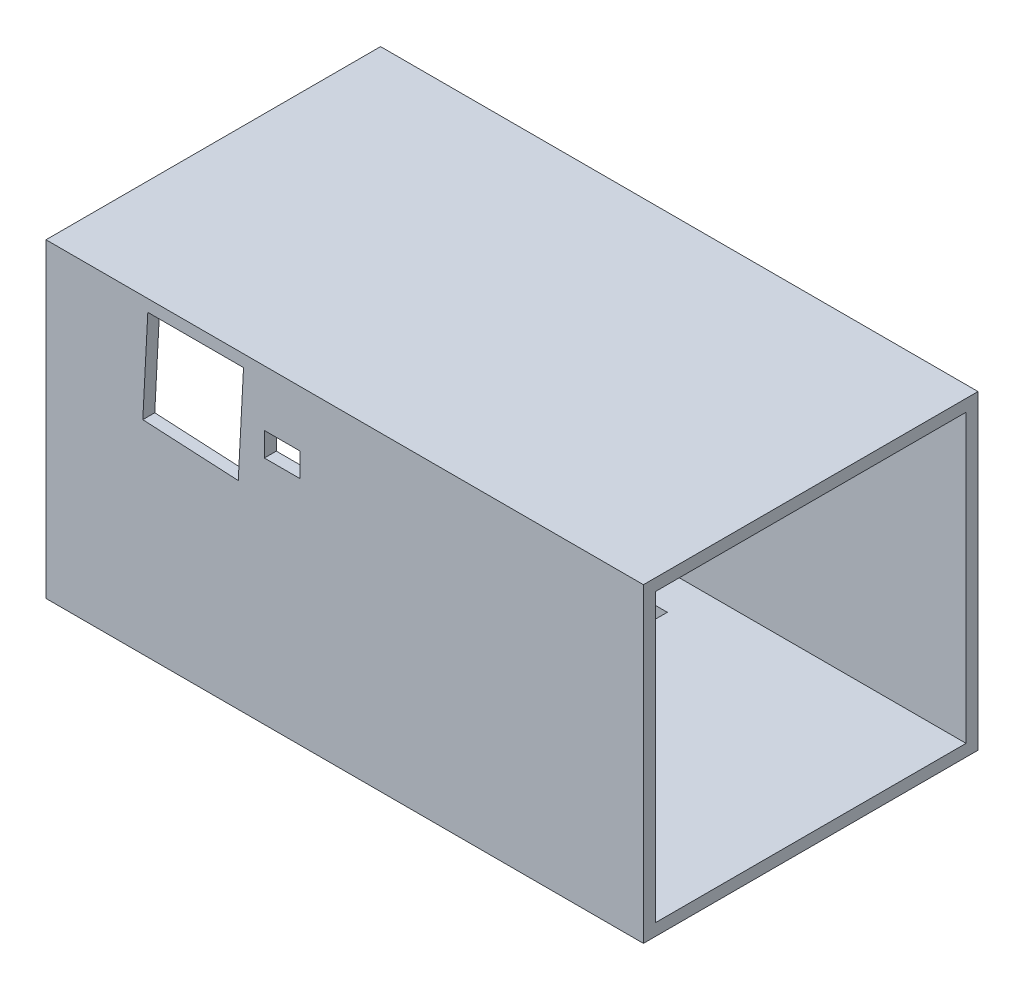
from build123d import *

# Parameters (mm, degrees)
SKETCH_C_W          = 250
SKETCH_C_H          = 70
BOSS_EXTRUDE1_DEPTH = 5
SKETCH2_W           = 250
SKETCH2_H           = 5
BOSS_EXTRUDE2_DEPTH = 120
SKETCH3_W           = 15
SKETCH3_H           = 10
CUT_EXTRUDE1_DEPTH  = 120
SKETCH4_W           = 140
SKETCH4_H           = 50
CUT_EXTRUDE2_DEPTH  = 5
SKETCH5_W           = 250
SKETCH5_H           = 70
BOSS_EXTRUDE3_DEPTH = 5


with BuildPart() as part:
    # Sketch C → Boss-Extrude1 (new body)
    with BuildSketch(Plane(origin=(0, 0, 0), x_dir=(1, 0, 0), z_dir=(0, 1, 0))):
        with Locations((125, 35)):
            Rectangle(SKETCH_C_W, SKETCH_C_H)
    extrude(amount=BOSS_EXTRUDE1_DEPTH)

    # Sketch2 → Boss-Extrude2 (add)
    with BuildSketch(Plane(origin=(0, 5, 0), x_dir=(1, 0, 0), z_dir=(0, 1, 0))):
        with Locations((125, 67.5)):
            Rectangle(SKETCH2_W, SKETCH2_H)
    extrude(amount=BOSS_EXTRUDE2_DEPTH)

    # Sketch3 → Cut-Extrude1 (cut)
    with BuildSketch(Plane.XY.offset(-65)):
        with Locations((98.873250263, 101.586143008)):
            Rectangle(SKETCH3_W, SKETCH3_H)
        Polygon((40.509305923, 85.05481861), (80.454487313, 82.96138036), (82.657638013, 125), (42.602744173, 125), align=None)
    extrude(amount=-CUT_EXTRUDE1_DEPTH, mode=Mode.SUBTRACT)

    # Sketch4 → Cut-Extrude2 (cut)
    with BuildSketch(Plane.XZ):
        with Locations((70, -25)):
            Rectangle(SKETCH4_W, SKETCH4_H)
    extrude(amount=-CUT_EXTRUDE2_DEPTH, mode=Mode.SUBTRACT)

    # Sketch5 → Boss-Extrude3 (add)
    with BuildSketch(Plane(origin=(0, 130, 0), x_dir=(1, 0, 0), z_dir=(0, 1, 0))):
        with Locations((125, 35)):
            Rectangle(SKETCH5_W, SKETCH5_H)
    extrude(amount=-BOSS_EXTRUDE3_DEPTH)

    # Mirror3: part across plane


with BuildPart() as part_1:
    add(part.part)
    add(part.part.mirror(Plane.XY))


solid = part_1.part
